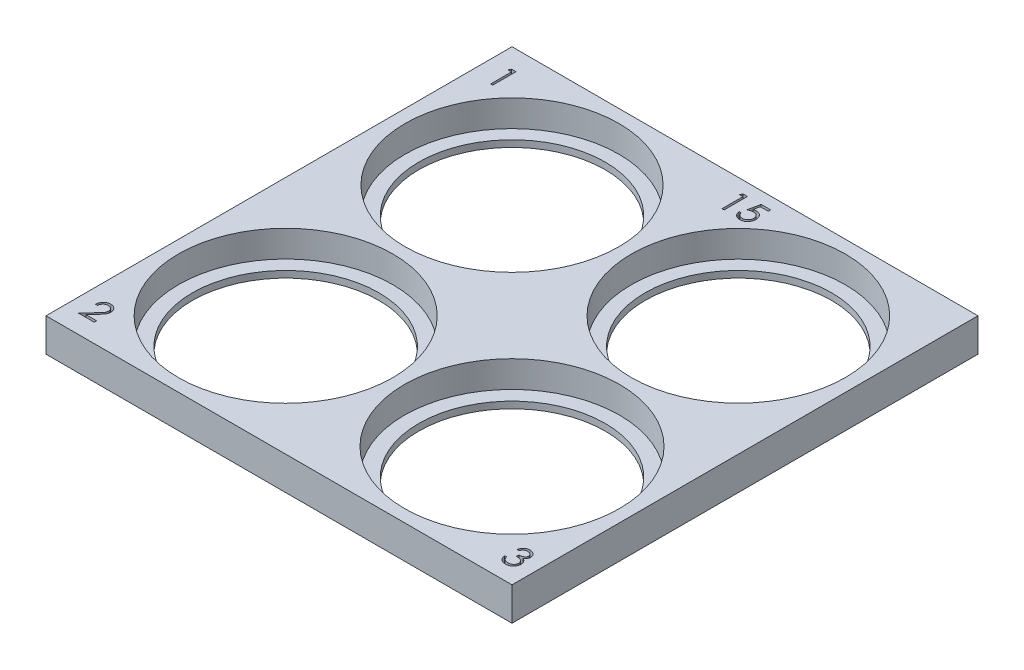
from build123d import *

# Parameters (mm, degrees)
SKETCH1_W           = 70
SKETCH1_H           = 70
BOSS_EXTRUDE1_DEPTH = 5
SKETCH2_R           = 16.05
SKETCH2_R_2         = 16.075
SKETCH2_R_3         = 16.1
SKETCH2_R_4         = 16.15
CUT_EXTRUDE1_DEPTH  = 4
SKETCH3_R           = 14
CUT_EXTRUDE2_DEPTH  = 76.593417486
CUT_EXTRUDE3_DEPTH  = 1


with BuildPart() as part:
    # Sketch1 → Boss-Extrude1 (new body)
    with BuildSketch(Plane(origin=(0, 0, 0), x_dir=(1, 0, 0), z_dir=(0, 1, 0))):
        with Locations((18.381962865, -18.289124668)):
            Rectangle(SKETCH1_W, SKETCH1_H)
    extrude(amount=BOSS_EXTRUDE1_DEPTH)

    # Sketch2 → Cut-Extrude1 (cut)
    with BuildSketch(Plane(origin=(0, 5, 0), x_dir=(1, 0, 0), z_dir=(0, 1, 0))):
        with Locations(Location((1.381962865, -1.289124668, 0), (0, 0, 270))):
            Circle(SKETCH2_R)
        with Locations(Location((35.381962865, -1.289124668, 0), (0, 0, 270))):
            Circle(SKETCH2_R_2)
        with Locations(Location((1.381962865, -35.289124668, 0), (0, 0, 270))):
            Circle(SKETCH2_R_3)
        with Locations(Location((35.381962865, -35.289124668, 0), (0, 0, 270))):
            Circle(SKETCH2_R_4)
    extrude(amount=-CUT_EXTRUDE1_DEPTH, mode=Mode.SUBTRACT)

    # Sketch3 → Cut-Extrude2 (cut, through all)
    with BuildSketch(Plane(origin=(0, 5, 0), x_dir=(1, 0, 0), z_dir=(0, 1, 0))):
        with Locations(Location((35.381962865, -1.289124668, 0), (0, 0, 270))):
            Circle(SKETCH3_R)
        with Locations(Location((1.381962865, -35.289124668, 0), (0, 0, 270))):
            Circle(SKETCH3_R)
        with Locations(Location((35.381962865, -35.289124668, 0), (0, 0, 270))):
            Circle(SKETCH3_R)
        with Locations(Location((1.381962865, -1.289124668, 0), (0, 0, 270))):
            Circle(SKETCH3_R)
    extrude(amount=-CUT_EXTRUDE2_DEPTH, mode=Mode.SUBTRACT)

    # Sketch4 → Cut-Extrude3 (cut)
    with BuildSketch(Plane(origin=(0, 5, 0), x_dir=(1, 0, 0), z_dir=(0, 1, 0))):
        Polygon((-13.715700026, 13.766018646), (-13.068564609, 13.766018646), (-13.068564609, 10.266018646), (-13.382667173, 10.266018646), (-13.382667173, 13.407044287), (-13.921128712, 13.407044287), align=None)
        Polygon((19.893087357, 14.916441686), (20.540222774, 14.916441686), (20.540222774, 11.416441686), (20.22612021, 11.416441686), (20.22612021, 14.557467327), (19.687658671, 14.557467327), align=None)
        with BuildLine():
            Line((24.040222774, 14.916441686), (24.040222774, 14.557467327))
            Line((24.040222774, 14.557467327), (22.850419088, 14.557467327))
            Line((22.850419088, 14.557467327), (22.661116203, 13.63689441))
            add(Edge.make_bspline(
                [(22.661116203, 13.63689441), (22.698172078, 13.647124682), (22.769961973, 13.666944216), (22.875921834, 13.688949986), (22.976514038, 13.70221543), (23.041789408, 13.704026741), (23.073375819, 13.704903225)],
                knots=[0, 0, 0, 0, 1.100273476, 2.13160584, 3.095893838, 4, 4, 4, 4], degree=3))
            add(Edge.make_bspline(
                [(23.073375819, 13.704903225), (23.112459558, 13.704057289), (23.189307956, 13.702393968), (23.301746903, 13.686422118), (23.409079796, 13.661282204), (23.511082166, 13.626161682), (23.607942717, 13.581251949), (23.698770278, 13.525152009), (23.784928191, 13.459618677), (23.864870785, 13.384273665), (23.937395093, 13.301352049), (24.001161083, 13.212194178), (24.055323673, 13.117666516), (24.098884428, 13.016865907), (24.133668762, 12.910906753), (24.156820757, 12.798674171), (24.172237466, 12.681226051), (24.173959853, 12.600921481), (24.174838158, 12.559971334)],
                knots=[0, 0, 0, 0, 1.052922333, 2.070308379, 3.05430497, 4.020497103, 4.973039431, 5.925935799, 6.892292201, 7.88610001, 8.88166317, 9.857072816, 10.836096531, 11.812156883, 12.81219415, 13.836441305, 14.89672472, 16, 16, 16, 16], degree=3))
            add(Edge.make_bspline(
                [(24.174838158, 12.559971334), (24.174173083, 12.531449113), (24.17285192, 12.474790126), (24.166133333, 12.390645925), (24.153197617, 12.308283092), (24.135829893, 12.2276907), (24.113287475, 12.149021328), (24.085998421, 12.0720498), (24.052602393, 11.997255193), (24.015971018, 11.923929798), (23.97472454, 11.853731291), (23.928946033, 11.788082304), (23.880580541, 11.725998023), (23.828539156, 11.66814429), (23.772338161, 11.614901272), (23.712658194, 11.56595299), (23.649975475, 11.52047166), (23.583320233, 11.480303465), (23.51417775, 11.443340509), (23.441549533, 11.413016972), (23.367088832, 11.385906443), (23.289723956, 11.364296916), (23.209630144, 11.347364361), (23.126675368, 11.335863761), (23.041294698, 11.327487323), (22.983419686, 11.326962966), (22.954185114, 11.326698096)],
                knots=[0, 0, 0, 0, 1.056347294, 2.098418968, 3.122841568, 4.141288669, 5.149314143, 6.15115421, 7.162517403, 8.180376062, 9.185164535, 10.17417709, 11.141909838, 12.097768115, 13.052685741, 14.0056014, 14.954263652, 15.917497458, 16.885230207, 17.854509472, 18.828990115, 19.81800267, 20.826176721, 21.857883937, 22.917946725, 24, 24, 24, 24], degree=3))
            add(Edge.make_bspline(
                [(22.954185114, 11.326698096), (22.919310933, 11.327388934), (22.850700102, 11.328748076), (22.750179535, 11.342966562), (22.653464929, 11.363330478), (22.561334828, 11.393966748), (22.472963564, 11.432354043), (22.389540847, 11.480870214), (22.308935071, 11.535849318), (22.234423034, 11.600729671), (22.16526692, 11.671645353), (22.103360412, 11.748602994), (22.048226835, 11.830332436), (22.000749088, 11.91723059), (21.960251067, 12.009069121), (21.928436078, 12.106192122), (21.902757723, 12.208092126), (21.891894303, 12.278245636), (21.88637662, 12.313877584)],
                knots=[0, 0, 0, 0, 1.0467383, 2.05933395, 3.04377827, 4.011590433, 4.970194871, 5.932262533, 6.905835911, 7.896367577, 8.894135286, 9.877477877, 10.858688626, 11.851381753, 12.8477658, 13.868841284, 14.917554742, 16, 16, 16, 16], degree=3))
            Line((21.88637662, 12.313877584), (22.200479184, 12.313877584))
            add(Edge.make_bspline(
                [(22.200479184, 12.313877584), (22.208207741, 12.280501131), (22.223062458, 12.216349736), (22.255668207, 12.126218395), (22.295534082, 12.045899171), (22.34293843, 11.974329588), (22.399488461, 11.911920591), (22.46401789, 11.856303529), (22.536365613, 11.806128399), (22.616758843, 11.764305632), (22.701571922, 11.728636879), (22.790339132, 11.704885184), (22.880643478, 11.688184291), (22.941721849, 11.68651253), (22.97241428, 11.685672455)],
                knots=[0, 0, 0, 0, 1.136247022, 2.183929868, 3.172523383, 4.106158343, 5.02341133, 5.958108904, 6.928429099, 7.938127109, 8.96079061, 9.975095812, 10.982467395, 12, 12, 12, 12], degree=3))
            add(Edge.make_bspline(
                [(22.97241428, 11.685672455), (23.002372725, 11.686493233), (23.061361147, 11.688109352), (23.148172533, 11.700548364), (23.231985408, 11.719705935), (23.311972764, 11.74837579), (23.389534304, 11.783220508), (23.462708074, 11.827935584), (23.533610952, 11.879395603), (23.600039085, 11.938352233), (23.660878534, 12.003321927), (23.714634656, 12.072799321), (23.759411569, 12.146916167), (23.797145678, 12.22438932), (23.825798977, 12.306067877), (23.846239958, 12.391569053), (23.858243017, 12.481104033), (23.859894197, 12.542173343), (23.860735594, 12.573292648)],
                knots=[0, 0, 0, 0, 1.027316725, 2.022795036, 3.002884548, 3.971462791, 4.93288096, 5.914575861, 6.907176829, 7.935150275, 8.956128384, 9.956726525, 10.942570165, 11.921478529, 12.907843606, 13.90538589, 14.932640048, 16, 16, 16, 16], degree=3))
            add(Edge.make_bspline(
                [(23.860735594, 12.573292648), (23.860077115, 12.601368399), (23.858788235, 12.656322688), (23.848257665, 12.736721895), (23.829940692, 12.812794937), (23.804516812, 12.884909171), (23.772237305, 12.953132613), (23.732790992, 13.017535674), (23.685437594, 13.077269507), (23.631345706, 13.13236206), (23.572087665, 13.183206935), (23.506643922, 13.226551022), (23.436383995, 13.263014939), (23.362154396, 13.294482938), (23.282189497, 13.317083683), (23.198072865, 13.334051569), (23.108896157, 13.343866931), (23.047925469, 13.34522882), (23.016584953, 13.345928866)],
                knots=[0, 0, 0, 0, 1.045622112, 2.046656509, 3.013763289, 3.955457236, 4.890082067, 5.820317437, 6.762574623, 7.722996705, 8.69280354, 9.665887285, 10.63943826, 11.638615906, 12.663482002, 13.728887084, 14.832589034, 16, 16, 16, 16], degree=3))
            add(Edge.make_bspline(
                [(23.016584953, 13.345928866), (22.989456024, 13.345348274), (22.933441669, 13.344149501), (22.847518842, 13.335323004), (22.757227119, 13.32108371), (22.662912624, 13.301497462), (22.564292116, 13.275866385), (22.461573715, 13.245151885), (22.354541448, 13.208429886), (22.282423724, 13.180697672), (22.245350979, 13.166441686)],
                knots=[0, 0, 0, 0, 0.817624296, 1.688186739, 2.600797293, 3.572016777, 4.590301741, 5.671205678, 6.80286297, 8, 8, 8, 8], degree=3))
            Line((22.245350979, 13.166441686), (22.604325338, 14.916441686))
            Line((22.604325338, 14.916441686), (24.040222774, 14.916441686))
        make_face()
        with BuildLine():
            Line((-14.093045376, -48.077892866), (-14.40714794, -48.077892866))
            add(Edge.make_bspline(
                [(-14.40714794, -48.077892866), (-14.405100787, -48.036221978), (-14.401080233, -47.954381463), (-14.382251944, -47.835057557), (-14.355311067, -47.721002758), (-14.317219613, -47.613132844), (-14.269913335, -47.510494037), (-14.213183307, -47.413494021), (-14.145989457, -47.322502833), (-14.069782723, -47.238363989), (-13.987014084, -47.161176418), (-13.897708144, -47.094521176), (-13.803863117, -47.038203504), (-13.705763718, -46.991122262), (-13.602303154, -46.955782417), (-13.494420297, -46.929560777), (-13.38164116, -46.913784431), (-13.304801138, -46.912088646), (-13.265721658, -46.911226199)],
                knots=[0, 0, 0, 0, 1.10065271, 2.161652631, 3.183658789, 4.190468796, 5.17591951, 6.163126047, 7.15150782, 8.156236427, 9.156009102, 10.134482811, 11.092018607, 12.041330605, 13.001268258, 13.972401359, 14.968799086, 16, 16, 16, 16], degree=3))
            add(Edge.make_bspline(
                [(-13.265721658, -46.911226199), (-13.227343584, -46.912124655), (-13.151932039, -46.91389009), (-13.041870025, -46.929051119), (-12.93709273, -46.952796711), (-12.837804964, -46.986112127), (-12.744798899, -47.030896555), (-12.657375855, -47.084694093), (-12.574495044, -47.146913925), (-12.49988826, -47.220167738), (-12.431380181, -47.298370123), (-12.372277926, -47.381858026), (-12.321664762, -47.468087312), (-12.279477083, -47.557715514), (-12.248420944, -47.651586542), (-12.224842736, -47.748333745), (-12.211515322, -47.848958556), (-12.209469898, -47.917065112), (-12.208429991, -47.951690943)],
                knots=[0, 0, 0, 0, 1.111607364, 2.184268762, 3.212621178, 4.221274766, 5.211760367, 6.196651075, 7.1921475, 8.207485113, 9.220403448, 10.201281604, 11.166441695, 12.114753415, 13.065576456, 14.026450734, 14.996634279, 16, 16, 16, 16], degree=3))
            add(Edge.make_bspline(
                [(-12.208429991, -47.951690943), (-12.210116636, -48.000440752), (-12.213460328, -48.09708488), (-12.242316031, -48.239289238), (-12.286898127, -48.377194297), (-12.340971157, -48.488173349), (-12.395591724, -48.577150242), (-12.44377152, -48.651065883), (-12.501423873, -48.7298923), (-12.568021286, -48.814423409), (-12.642559092, -48.904917779), (-12.72557376, -49.001412545), (-12.817699451, -49.10288285), (-12.882357632, -49.172188663), (-12.915861882, -49.208101199)],
                knots=[0, 0, 0, 0, 1.184203166, 2.347625244, 3.513805382, 4.700623107, 5.337941753, 6.051866363, 6.845199593, 7.711357327, 8.668078039, 9.695487809, 10.805859518, 12, 12, 12, 12], degree=3))
            Line((-12.915861882, -49.208101199), (-13.791563004, -50.14199543))
            Line((-13.791563004, -50.14199543), (-12.163558196, -50.14199543))
            Line((-12.163558196, -50.14199543), (-12.163558196, -50.500969789))
            Line((-12.163558196, -50.500969789), (-14.541763325, -50.500969789))
            Line((-14.541763325, -50.500969789), (-13.18439153, -49.05245216))
            add(Edge.make_bspline(
                [(-13.18439153, -49.05245216), (-13.151343643, -49.017953854), (-13.087865416, -48.951689667), (-12.998082839, -48.854946707), (-12.917443851, -48.765197166), (-12.845426458, -48.682610618), (-12.783592953, -48.60597905), (-12.728720721, -48.537784347), (-12.68475513, -48.475029896), (-12.637039734, -48.402289282), (-12.590825753, -48.313476965), (-12.551113397, -48.204943276), (-12.526898548, -48.093216023), (-12.523993713, -48.017713986), (-12.522532555, -47.979735814)],
                knots=[0, 0, 0, 0, 1.329631726, 2.553950428, 3.673215718, 4.687767853, 5.603093632, 6.413772471, 7.123043292, 7.734684054, 8.834405432, 9.900288307, 10.943827018, 12, 12, 12, 12], degree=3))
            add(Edge.make_bspline(
                [(-12.522532555, -47.979735814), (-12.523168298, -47.955854416), (-12.524421224, -47.908788766), (-12.535478921, -47.839783007), (-12.552189427, -47.773218193), (-12.576134685, -47.708889574), (-12.607741425, -47.647443922), (-12.646214805, -47.588806441), (-12.690604869, -47.532117476), (-12.741956138, -47.478964178), (-12.798367658, -47.430282973), (-12.857961908, -47.387158887), (-12.921012012, -47.351119776), (-12.987252134, -47.321576279), (-13.056497603, -47.298400898), (-13.128882348, -47.282342319), (-13.204206365, -47.272259835), (-13.25563986, -47.270895663), (-13.281847459, -47.270200558)],
                knots=[0, 0, 0, 0, 0.991446411, 1.95395049, 2.89581595, 3.838931463, 4.798493298, 5.75982156, 6.748411868, 7.785213223, 8.824556874, 9.840280684, 10.836137867, 11.835679398, 12.848801643, 13.863922112, 14.911575587, 16, 16, 16, 16], degree=3))
            add(Edge.make_bspline(
                [(-13.281847459, -47.270200558), (-13.309218292, -47.27091559), (-13.362970088, -47.272319795), (-13.441889121, -47.282142459), (-13.517174899, -47.2990883), (-13.589016802, -47.322264974), (-13.657536387, -47.351723523), (-13.722400432, -47.388415268), (-13.783463321, -47.432198761), (-13.840839844, -47.481839317), (-13.893703823, -47.537106918), (-13.940150699, -47.598716882), (-13.980734713, -47.665544297), (-14.016143947, -47.737408847), (-14.044899637, -47.814962627), (-14.066872787, -47.897930332), (-14.084259634, -47.985951714), (-14.090068155, -48.046736799), (-14.093045376, -48.077892866)],
                knots=[0, 0, 0, 0, 1.031018746, 2.02475058, 2.990194455, 3.934040569, 4.864654155, 5.795059489, 6.735614925, 7.690564532, 8.649604399, 9.611025574, 10.590972636, 11.591080095, 12.624614302, 13.701020113, 14.821632451, 16, 16, 16, 16], degree=3))
        make_face()
        with BuildLine():
            Line((49.467827585, -48.301700542), (49.15372502, -48.301700542))
            add(Edge.make_bspline(
                [(49.15372502, -48.301700542), (49.162234571, -48.266468058), (49.178870047, -48.197591434), (49.21356762, -48.099184173), (49.251366875, -48.006060652), (49.29675598, -47.919964578), (49.346264734, -47.839165675), (49.402987456, -47.765496551), (49.464307178, -47.697083585), (49.532132128, -47.636370348), (49.603260789, -47.581392618), (49.678695409, -47.534517561), (49.756918303, -47.494193408), (49.838471436, -47.460973176), (49.923597607, -47.435947653), (50.011527231, -47.417790847), (50.102490731, -47.405999733), (50.164238321, -47.40484897), (50.195592008, -47.404264645)],
                knots=[0, 0, 0, 0, 1.162005537, 2.271625781, 3.343758855, 4.383309926, 5.390229558, 6.379919256, 7.361854164, 8.333198761, 9.295911338, 10.242430842, 11.177959212, 12.116337295, 13.062827104, 14.020064771, 14.994644689, 16, 16, 16, 16], degree=3))
            add(Edge.make_bspline(
                [(50.195592008, -47.404264645), (50.24127475, -47.405643875), (50.331643761, -47.40837225), (50.464406808, -47.433286687), (50.592433627, -47.472711819), (50.714322875, -47.527185546), (50.827541307, -47.59437286), (50.928277494, -47.674337596), (51.015166005, -47.765536898), (51.088060382, -47.866269462), (51.145135381, -47.973924972), (51.187221755, -48.084725129), (51.212843436, -48.1984071), (51.216163993, -48.275164379), (51.217827585, -48.313619613)],
                knots=[0, 0, 0, 0, 1.083050992, 2.142477498, 3.193116406, 4.255571735, 5.30263384, 6.308962982, 7.297363603, 8.282367274, 9.249857812, 10.179914175, 11.08814088, 12, 12, 12, 12], degree=3))
            add(Edge.make_bspline(
                [(51.217827585, -48.313619613), (51.216663994, -48.350626407), (51.214387026, -48.423042962), (51.195053321, -48.528764459), (51.162517058, -48.628406059), (51.117447295, -48.722387221), (51.059105745, -48.810112061), (50.988433048, -48.891777952), (50.904930386, -48.96774711), (50.841651448, -49.011266583), (50.809073578, -49.033671696)],
                knots=[0, 0, 0, 0, 1.024540389, 2.004866551, 2.965041327, 3.920577974, 4.882998113, 5.874504559, 6.905732034, 8, 8, 8, 8], degree=3))
            add(Edge.make_bspline(
                [(50.809073578, -49.033671696), (50.846305333, -49.051649867), (50.920072207, -49.087269825), (51.020622737, -49.157125583), (51.111900612, -49.23778193), (51.162804331, -49.300724583), (51.188380469, -49.332349581)],
                knots=[0, 0, 0, 0, 1.015518401, 2.012035669, 3.001164323, 4, 4, 4, 4], degree=3))
            add(Edge.make_bspline(
                [(51.188380469, -49.332349581), (51.205221812, -49.355407332), (51.238628708, -49.401145249), (51.279864241, -49.474681675), (51.317273356, -49.549033164), (51.346423575, -49.62619257), (51.368997442, -49.705265584), (51.385133474, -49.78638798), (51.395157615, -49.869626002), (51.396593167, -49.925938482), (51.397314764, -49.954244613)],
                knots=[0, 0, 0, 0, 1.025084078, 2.033381695, 3.024893161, 4.013698104, 4.991890475, 5.976764909, 6.982997093, 8, 8, 8, 8], degree=3))
            add(Edge.make_bspline(
                [(51.397314764, -49.954244613), (51.395520251, -50.003254334), (51.391939669, -50.101043136), (51.359935594, -50.245517857), (51.310322354, -50.38674336), (51.239865418, -50.521818199), (51.153997909, -50.64819858), (51.051840585, -50.761274889), (50.934554176, -50.858473493), (50.803748527, -50.939683721), (50.662031399, -51.004601643), (50.510455807, -51.049659086), (50.351205753, -51.079005086), (50.241998455, -51.082151955), (50.186477424, -51.083751824)],
                knots=[0, 0, 0, 0, 0.955779014, 1.907060117, 2.875433937, 3.871313158, 4.872415639, 5.851225146, 6.836215519, 7.83643374, 8.849228613, 9.86973379, 10.916971861, 12, 12, 12, 12], degree=3))
            add(Edge.make_bspline(
                [(50.186477424, -51.083751824), (50.149058124, -51.082883611), (50.075429419, -51.081175257), (49.967185921, -51.069496656), (49.863864221, -51.04816665), (49.765324623, -51.019463345), (49.671479587, -50.983071603), (49.582615482, -50.937752905), (49.498185588, -50.884441403), (49.418986637, -50.822507815), (49.345028069, -50.753226475), (49.278275345, -50.675367465), (49.217615552, -50.590370061), (49.164672914, -50.497247005), (49.117035961, -50.397201748), (49.077855004, -50.288953249), (49.043369436, -50.173469227), (49.027335971, -50.092991487), (49.019109636, -50.051700542)],
                knots=[0, 0, 0, 0, 1.048658725, 2.063410685, 3.046034179, 4.001477787, 4.936774919, 5.862367409, 6.792675028, 7.730719943, 8.675894397, 9.627829632, 10.600096036, 11.597688215, 12.626045268, 13.701542398, 14.82072376, 16, 16, 16, 16], degree=3))
            Line((49.019109636, -50.051700542), (49.3332122, -50.051700542))
            add(Edge.make_bspline(
                [(49.3332122, -50.051700542), (49.341395491, -50.078649555), (49.357312704, -50.131067727), (49.384407002, -50.206508033), (49.415275274, -50.275666086), (49.448389833, -50.339049208), (49.483168279, -50.39728161), (49.522083204, -50.448823479), (49.562252349, -50.495938682), (49.592531702, -50.522483294), (49.607350822, -50.535474581)],
                knots=[0, 0, 0, 0, 1.198163088, 2.33053128, 3.407730985, 4.417276592, 5.372219308, 6.28897303, 7.162600585, 8, 8, 8, 8], degree=3))
            add(Edge.make_bspline(
                [(49.607350822, -50.535474581), (49.626947398, -50.550582914), (49.666080061, -50.580752946), (49.729848292, -50.619254575), (49.796913178, -50.6526156), (49.868727853, -50.678099296), (49.943742623, -50.699676957), (50.023169988, -50.713797476), (50.106309205, -50.723485647), (50.163076969, -50.724340579), (50.192086399, -50.724777465)],
                knots=[0, 0, 0, 0, 0.946170439, 1.889420265, 2.845303464, 3.807233317, 4.801018734, 5.828864929, 6.890507805, 8, 8, 8, 8], degree=3))
            add(Edge.make_bspline(
                [(50.192086399, -50.724777465), (50.224839901, -50.72416156), (50.288886548, -50.72295721), (50.382341408, -50.711881504), (50.471248855, -50.69575109), (50.554621781, -50.670838107), (50.633552288, -50.640057256), (50.706933938, -50.60140885), (50.775730044, -50.556064129), (50.839059449, -50.50452497), (50.896004957, -50.448103475), (50.94614447, -50.389090404), (50.988769132, -50.327734574), (51.02315271, -50.263696453), (51.05030326, -50.197241225), (51.068786461, -50.128182395), (51.081637976, -50.057085129), (51.082684588, -50.00875616), (51.0832122, -49.98439285)],
                knots=[0, 0, 0, 0, 1.217147791, 2.380027433, 3.494444702, 4.572153297, 5.609568379, 6.639424714, 7.649109417, 8.668170816, 9.669597737, 10.625200337, 11.543417969, 12.441394052, 13.322311151, 14.205496177, 15.095365482, 16, 16, 16, 16], degree=3))
            add(Edge.make_bspline(
                [(51.0832122, -49.98439285), (51.081681898, -49.951781511), (51.07862891, -49.886721103), (51.05532033, -49.791003528), (51.016981466, -49.698780116), (50.963308955, -49.611624326), (50.897973226, -49.530848424), (50.821608319, -49.458776942), (50.733580091, -49.399306851), (50.652560222, -49.358218194), (50.580795066, -49.330181119), (50.519379681, -49.311506155), (50.450623078, -49.295692499), (50.375356729, -49.280980228), (50.293013512, -49.268458879), (50.203683074, -49.258017064), (50.107347313, -49.249662023), (50.040656147, -49.245930927), (50.006289123, -49.244008234)],
                knots=[0, 0, 0, 0, 1.07054697, 2.135767047, 3.216561865, 4.33974944, 5.486079747, 6.621378074, 7.775625952, 8.963672916, 9.598146892, 10.304877434, 11.070270905, 11.915000392, 12.823868403, 13.805723172, 14.86925407, 16, 16, 16, 16], degree=3))
            Line((50.006289123, -49.244008234), (50.006289123, -48.885033875))
            add(Edge.make_bspline(
                [(50.006289123, -48.885033875), (50.049590289, -48.884299072), (50.134406635, -48.882859772), (50.25830094, -48.865451761), (50.376774252, -48.841371133), (50.487200994, -48.804485941), (50.587849708, -48.761645644), (50.67516931, -48.711793435), (50.747936457, -48.656378685), (50.805797528, -48.594546076), (50.849326757, -48.528231029), (50.881153554, -48.459114371), (50.899953881, -48.38659031), (50.902463548, -48.337095642), (50.90372502, -48.312217369)],
                knots=[0, 0, 0, 0, 1.321986639, 2.589447074, 3.816329219, 5.01088745, 6.139805852, 7.153945165, 8.075214402, 8.924034688, 9.728124013, 10.488707548, 11.240355623, 12, 12, 12, 12], degree=3))
            add(Edge.make_bspline(
                [(50.90372502, -48.312217369), (50.903310609, -48.293939624), (50.902486159, -48.257576917), (50.892088881, -48.204451848), (50.87646484, -48.152950902), (50.85498511, -48.103293092), (50.826234912, -48.055822818), (50.791828925, -48.010135369), (50.750860825, -47.96649159), (50.703915378, -47.925811271), (50.653503573, -47.887042033), (50.598253798, -47.854128396), (50.539831923, -47.825983334), (50.478173268, -47.802773832), (50.413077738, -47.785314544), (50.34485118, -47.772778703), (50.273363497, -47.764941048), (50.224591765, -47.763812632), (50.199798738, -47.763239004)],
                knots=[0, 0, 0, 0, 0.884392785, 1.759457502, 2.611959086, 3.489218968, 4.37281399, 5.2945488, 6.255912374, 7.266815255, 8.301784654, 9.332968512, 10.37626691, 11.440494194, 12.520033166, 13.637162961, 14.798855837, 16, 16, 16, 16], degree=3))
            add(Edge.make_bspline(
                [(50.199798738, -47.763239004), (50.15994707, -47.764630366), (50.082107494, -47.767348019), (49.969892577, -47.791151033), (49.865573243, -47.829129116), (49.785834577, -47.874462136), (49.726952002, -47.919212569), (49.684875064, -47.958294956), (49.643554554, -48.00172778), (49.605708877, -48.052186155), (49.5674349, -48.106252945), (49.532590339, -48.166676627), (49.498730646, -48.231881021), (49.478328097, -48.277976655), (49.467827585, -48.301700542)],
                knots=[0, 0, 0, 0, 1.472543308, 2.876219568, 4.221790263, 5.565193594, 6.249813518, 6.953379497, 7.687249741, 8.463570142, 9.283606569, 10.136032583, 11.040678096, 12, 12, 12, 12], degree=3))
        make_face()
    extrude(amount=-CUT_EXTRUDE3_DEPTH, mode=Mode.SUBTRACT)


solid = part.part
